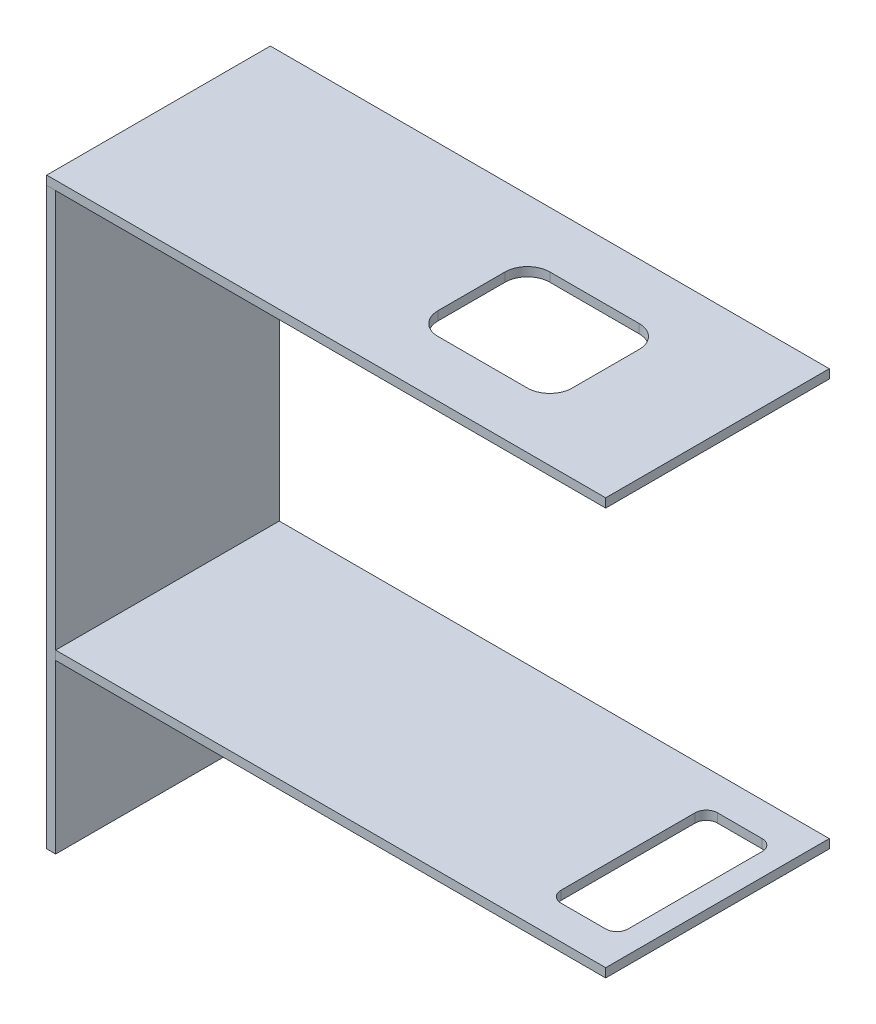
from build123d import *

# Parameters (mm, degrees)
SKETCH1_W           = 250
SKETCH1_H           = 4
BOSS_EXTRUDE1_DEPTH = 100
BOSS_EXTRUDE2_DEPTH = 100
SKETCH1_4_W         = 246
SKETCH1_4_H         = 4
BOSS_EXTRUDE3_DEPTH = 100
CUT_EXTRUDE1_DEPTH  = 4
CUT_EXTRUDE2_START  = -4
CUT_EXTRUDE2_DEPTH  = 4


with BuildPart() as part:
    # Sketch1 → Boss-Extrude1 (new body)
    with BuildSketch(Plane.XY):
        with Locations((-1, 130.5)):
            Rectangle(SKETCH1_W, SKETCH1_H)
    extrude(amount=BOSS_EXTRUDE1_DEPTH)

    # Sketch3 → Cut-Extrude2 (cut)
    with BuildSketch(Plane(origin=(0, 132.5, 0), x_dir=(1, 0, 0), z_dir=(0, 1, 0)).offset(CUT_EXTRUDE2_START)):
        with BuildLine():
            Line((14, -65), (14, -35))
            ThreePointArc((14, -35), (16.928932188, -27.928932188), (24, -25))
            Line((24, -25), (64, -25))
            ThreePointArc((64, -25), (71.071067812, -27.928932188), (74, -35))
            Line((74, -35), (74, -65))
            ThreePointArc((74, -65), (71.071067812, -72.071067812), (64, -75))
            Line((64, -75), (24, -75))
            ThreePointArc((24, -75), (16.928932188, -72.071067812), (14, -65))
        make_face()
    extrude(amount=CUT_EXTRUDE2_DEPTH, mode=Mode.SUBTRACT)


with BuildPart() as body_2:
    # Sketch1<3> → Boss-Extrude2 (new body)
    with BuildSketch(Plane.XY):
        Polygon((-122, -128.5), (-122, -53.5), (-122, -49.5), (-122, 128.5), (-126, 128.5), (-126, -128.5), align=None)
    extrude(amount=BOSS_EXTRUDE2_DEPTH)


with BuildPart() as body_3:
    # Sketch1<4> → Boss-Extrude3 (new body)
    with BuildSketch(Plane.XY):
        with Locations((1, -51.5)):
            Rectangle(SKETCH1_4_W, SKETCH1_4_H)
    extrude(amount=BOSS_EXTRUDE3_DEPTH)

    # Sketch2 → Cut-Extrude1 (cut)
    with BuildSketch(Plane(origin=(0, -49.5, 0), x_dir=(1, 0, 0), z_dir=(0, 1, 0))):
        with BuildLine():
            Line((89, -15), (109, -15))
            ThreePointArc((109, -15), (112.535533906, -16.464466094), (114, -20))
            Line((114, -20), (114, -80))
            ThreePointArc((114, -80), (112.535533906, -83.535533906), (109, -85))
            Line((109, -85), (89, -85))
            ThreePointArc((89, -85), (85.464466094, -83.535533906), (84, -80))
            Line((84, -80), (84, -20))
            ThreePointArc((84, -20), (85.464466094, -16.464466094), (89, -15))
        make_face()
    extrude(amount=-CUT_EXTRUDE1_DEPTH, mode=Mode.SUBTRACT)


solid = Compound([part.part, body_2.part, body_3.part])
